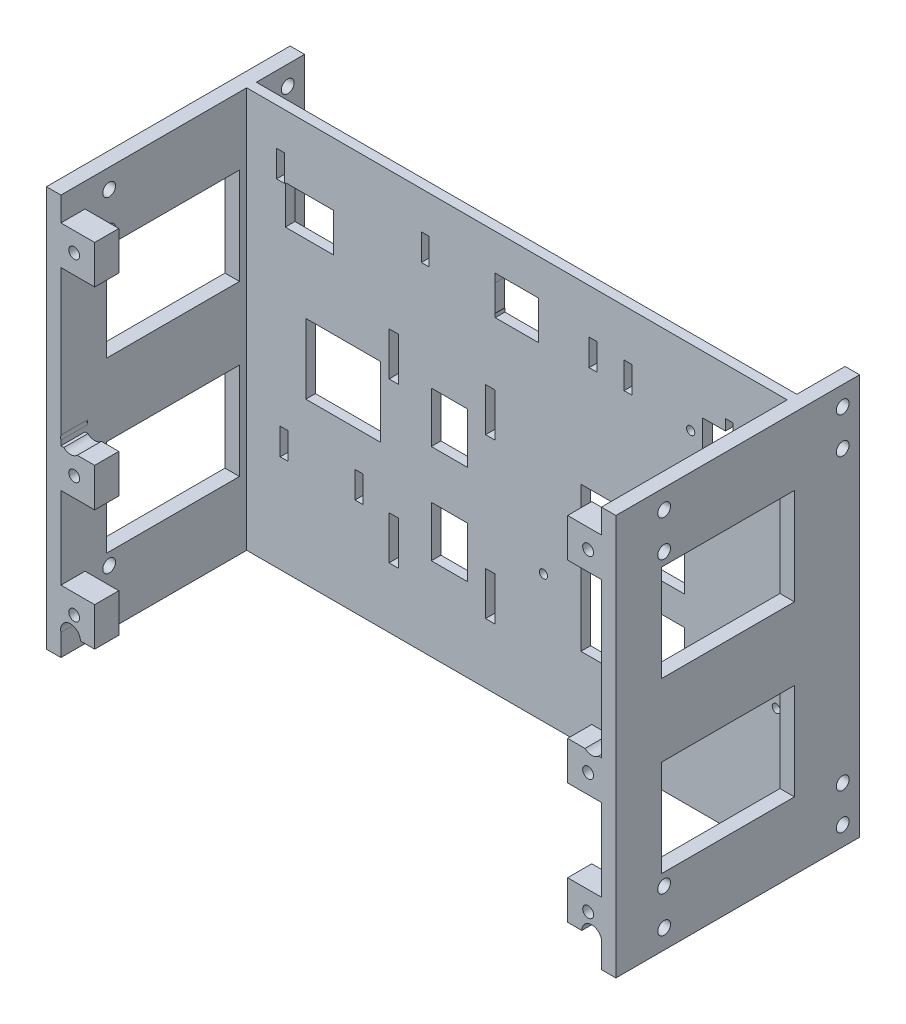
from build123d import *

# Parameters (mm, degrees)
BOTTOM_PAN_START                       = -49
SKETCH_BOTTOM_PAN_W                    = 236
SKETCH_BOTTOM_PAN_H                    = 166
BOTTOM_PAN_DEPTH                       = 4
SIDE_RAILS_START                       = -69
SKETCH_SIDE_RAILS_W                    = 6
SKETCH_SIDE_RAILS_H                    = 166
SIDE_RAILS_DEPTH                       = 101
FLOOR_VENTS_AND_STRAP_SLOTS_START      = -50
SKETCH_FLOOR_VENTS_AND_STRAP_SLOTS_W   = 4
SKETCH_FLOOR_VENTS_AND_STRAP_SLOTS_H   = 18
SKETCH_FLOOR_VENTS_AND_STRAP_SLOTS_W_2 = 15
SKETCH_FLOOR_VENTS_AND_STRAP_SLOTS_H_2 = 21
SKETCH_FLOOR_VENTS_AND_STRAP_SLOTS_W_3 = 3.2
SKETCH_FLOOR_VENTS_AND_STRAP_SLOTS_H_3 = 11
SKETCH_FLOOR_VENTS_AND_STRAP_SLOTS_W_4 = 31
SKETCH_FLOOR_VENTS_AND_STRAP_SLOTS_H_4 = 29
SKETCH_FLOOR_VENTS_AND_STRAP_SLOTS_W_5 = 20
SKETCH_FLOOR_VENTS_AND_STRAP_SLOTS_H_5 = 16
SKETCH_FLOOR_VENTS_AND_STRAP_SLOTS_W_6 = 43
SKETCH_FLOOR_VENTS_AND_STRAP_SLOTS_H_6 = 30
FLOOR_VENTS_AND_STRAP_SLOTS_DEPTH      = 7
RAIL_WINDOWS_START                     = -42
SKETCH_RAIL_WINDOWS_W                  = 9
SKETCH_RAIL_WINDOWS_H                  = 40
RAIL_WINDOWS_DEPTH                     = 55
HIP_M5_CROSS_BORES_START               = -120
SKETCH_HIP_M5_CROSS_BORES_R            = 2.65
HIP_M5_CROSS_BORES_DEPTH               = 240
SIX_DECK_BOSSES_START                  = 22
SKETCH_SIX_DECK_BOSSES_W               = 20
SKETCH_SIX_DECK_BOSSES_H               = 16
SIX_DECK_BOSSES_DEPTH                  = 10
POWER_TRAY_M3_START                    = -50
SKETCH_POWER_TRAY_M3_R                 = 1.7
POWER_TRAY_M3_DEPTH                    = 7
DECK_M4_CLEARANCE_START                = 21
SKETCH_DECK_M4_CLEARANCE_R             = 2.25
DECK_M4_CLEARANCE_DEPTH                = 12
MID_HEAD_AND_TOOL_PASSAGES_START       = 21
SKETCH_MID_HEAD_AND_TOOL_PASSAGES_R    = 4.1
MID_HEAD_AND_TOOL_PASSAGES_DEPTH       = 12
M4_HEX_CAPTURE_AF7P3_START             = 21
M4_HEX_CAPTURE_AF7P3_DEPTH             = 4.4


with BuildPart() as part:
    # Sketch_Bottom_pan → Bottom_pan (new body)
    with BuildSketch(Plane.XY.offset(BOTTOM_PAN_START)):
        Rectangle(SKETCH_BOTTOM_PAN_W, SKETCH_BOTTOM_PAN_H)
    extrude(amount=BOTTOM_PAN_DEPTH)

    # Sketch_Side_rails → Side_rails (add)
    with BuildSketch(Plane.XY.offset(SIDE_RAILS_START)):
        with Locations((-115, 0)):
            Rectangle(SKETCH_SIDE_RAILS_W, SKETCH_SIDE_RAILS_H)
        with Locations((115, 0)):
            Rectangle(SKETCH_SIDE_RAILS_W, SKETCH_SIDE_RAILS_H)
    extrude(amount=SIDE_RAILS_DEPTH)

    # Sketch_Floor_vents_and_strap_slots → Floor_vents_and_strap_slots (cut)
    with BuildSketch(Plane.XY.offset(FLOOR_VENTS_AND_STRAP_SLOTS_START)):
        with Locations((-51, -49)):
            Rectangle(SKETCH_FLOOR_VENTS_AND_STRAP_SLOTS_W, SKETCH_FLOOR_VENTS_AND_STRAP_SLOTS_H)
        with Locations((-28, -38)):
            Rectangle(SKETCH_FLOOR_VENTS_AND_STRAP_SLOTS_W_2, SKETCH_FLOOR_VENTS_AND_STRAP_SLOTS_H_2)
        with Locations((-96.5, -37)):
            Rectangle(SKETCH_FLOOR_VENTS_AND_STRAP_SLOTS_W_3, SKETCH_FLOOR_VENTS_AND_STRAP_SLOTS_H_3)
        with Locations((-65.5, -37)):
            Rectangle(SKETCH_FLOOR_VENTS_AND_STRAP_SLOTS_W_3, SKETCH_FLOOR_VENTS_AND_STRAP_SLOTS_H_3)
        with Locations((-72, -2)):
            Rectangle(SKETCH_FLOOR_VENTS_AND_STRAP_SLOTS_W_4, SKETCH_FLOOR_VENTS_AND_STRAP_SLOTS_H_4)
        with Locations((-28, 3)):
            Rectangle(SKETCH_FLOOR_VENTS_AND_STRAP_SLOTS_W_2, SKETCH_FLOOR_VENTS_AND_STRAP_SLOTS_H_2)
        with Locations((-51, 17)):
            Rectangle(SKETCH_FLOOR_VENTS_AND_STRAP_SLOTS_W, SKETCH_FLOOR_VENTS_AND_STRAP_SLOTS_H)
        with Locations((-86, 49)):
            Rectangle(SKETCH_FLOOR_VENTS_AND_STRAP_SLOTS_W_5, SKETCH_FLOOR_VENTS_AND_STRAP_SLOTS_H_5)
        with Locations((-98, 62)):
            Rectangle(SKETCH_FLOOR_VENTS_AND_STRAP_SLOTS_W_3, SKETCH_FLOOR_VENTS_AND_STRAP_SLOTS_H_3)
        with Locations((-38, 62)):
            Rectangle(SKETCH_FLOOR_VENTS_AND_STRAP_SLOTS_W_3, SKETCH_FLOOR_VENTS_AND_STRAP_SLOTS_H_3)
        with Locations((-11, -49)):
            Rectangle(SKETCH_FLOOR_VENTS_AND_STRAP_SLOTS_W, SKETCH_FLOOR_VENTS_AND_STRAP_SLOTS_H)
        with Locations((48, -35)):
            Rectangle(SKETCH_FLOOR_VENTS_AND_STRAP_SLOTS_W_6, SKETCH_FLOOR_VENTS_AND_STRAP_SLOTS_H_6)
        with Locations((48, 1)):
            Rectangle(SKETCH_FLOOR_VENTS_AND_STRAP_SLOTS_W_6, SKETCH_FLOOR_VENTS_AND_STRAP_SLOTS_H)
        with Locations((-11, 17)):
            Rectangle(SKETCH_FLOOR_VENTS_AND_STRAP_SLOTS_W, SKETCH_FLOOR_VENTS_AND_STRAP_SLOTS_H)
        Polygon((77, 45), (77, 59), (86.4, 59), (86.4, 63.5), (89.6, 63.5), (89.6, 59), (95, 59), (95, 45), align=None)
        with Locations((46, 58)):
            Rectangle(SKETCH_FLOOR_VENTS_AND_STRAP_SLOTS_W_3, SKETCH_FLOOR_VENTS_AND_STRAP_SLOTS_H_3)
        Polygon((-9, 68), (9, 68), (9, 52), (-9, 52), (-9, 53.5), (-9.1, 53.5), (-9.1, 64.5), (-9, 64.5), align=None)
        with Locations((31.5, 59)):
            Rectangle(SKETCH_FLOOR_VENTS_AND_STRAP_SLOTS_W_3, SKETCH_FLOOR_VENTS_AND_STRAP_SLOTS_H_3)
    extrude(amount=FLOOR_VENTS_AND_STRAP_SLOTS_DEPTH, mode=Mode.SUBTRACT)

    # Sketch_Rail_windows → Rail_windows (cut)
    with BuildSketch(Plane.XY.offset(RAIL_WINDOWS_START)):
        with Locations((-115, -35)):
            Rectangle(SKETCH_RAIL_WINDOWS_W, SKETCH_RAIL_WINDOWS_H)
        with Locations((115, -35)):
            Rectangle(SKETCH_RAIL_WINDOWS_W, SKETCH_RAIL_WINDOWS_H)
        with Locations((-115, 35)):
            Rectangle(SKETCH_RAIL_WINDOWS_W, SKETCH_RAIL_WINDOWS_H)
        with Locations((115, 35)):
            Rectangle(SKETCH_RAIL_WINDOWS_W, SKETCH_RAIL_WINDOWS_H)
    extrude(amount=RAIL_WINDOWS_DEPTH, mode=Mode.SUBTRACT)

    # Sketch_Hip_M5_cross_bores → Hip_M5_cross_bores (cut)
    with BuildSketch(Plane(origin=(0, 0, 0), x_dir=(0, 0, -1), z_dir=(1, 0, 0)).offset(HIP_M5_CROSS_BORES_START)):
        with Locations(Location((62, -75, 0), (0, 0, 180))):
            Circle(SKETCH_HIP_M5_CROSS_BORES_R)
        with Locations(Location((-12, -75, 0), (0, 0, 180))):
            Circle(SKETCH_HIP_M5_CROSS_BORES_R)
        with Locations(Location((62, -60, 0), (0, 0, 180))):
            Circle(SKETCH_HIP_M5_CROSS_BORES_R)
        with Locations(Location((-12, -60, 0), (0, 0, 180))):
            Circle(SKETCH_HIP_M5_CROSS_BORES_R)
        with Locations(Location((62, 60, 0), (0, 0, 180))):
            Circle(SKETCH_HIP_M5_CROSS_BORES_R)
        with Locations(Location((-12, 60, 0), (0, 0, 180))):
            Circle(SKETCH_HIP_M5_CROSS_BORES_R)
        with Locations(Location((62, 75, 0), (0, 0, 180))):
            Circle(SKETCH_HIP_M5_CROSS_BORES_R)
        with Locations(Location((-12, 75, 0), (0, 0, 180))):
            Circle(SKETCH_HIP_M5_CROSS_BORES_R)
    extrude(amount=HIP_M5_CROSS_BORES_DEPTH, mode=Mode.SUBTRACT)

    # Sketch_Six_deck_bosses → Six_deck_bosses (add)
    with BuildSketch(Plane.XY.offset(SIX_DECK_BOSSES_START)):
        with Locations((-108, -65)):
            Rectangle(SKETCH_SIX_DECK_BOSSES_W, SKETCH_SIX_DECK_BOSSES_H)
        with Locations((108, -65)):
            Rectangle(SKETCH_SIX_DECK_BOSSES_W, SKETCH_SIX_DECK_BOSSES_H)
        with Locations((-108, -15)):
            Rectangle(SKETCH_SIX_DECK_BOSSES_W, SKETCH_SIX_DECK_BOSSES_H)
        with Locations((108, -15)):
            Rectangle(SKETCH_SIX_DECK_BOSSES_W, SKETCH_SIX_DECK_BOSSES_H)
        with Locations((-108, 65)):
            Rectangle(SKETCH_SIX_DECK_BOSSES_W, SKETCH_SIX_DECK_BOSSES_H)
        with Locations((108, 65)):
            Rectangle(SKETCH_SIX_DECK_BOSSES_W, SKETCH_SIX_DECK_BOSSES_H)
    extrude(amount=SIX_DECK_BOSSES_DEPTH)

    # Sketch_Power_tray_M3 → Power_tray_M3 (cut)
    with BuildSketch(Plane.XY.offset(POWER_TRAY_M3_START)):
        with Locations((11, -30)):
            Circle(SKETCH_POWER_TRAY_M3_R)
        with Locations((107.5, -30)):
            Circle(SKETCH_POWER_TRAY_M3_R)
        with Locations((72, 52)):
            Circle(SKETCH_POWER_TRAY_M3_R)
    extrude(amount=POWER_TRAY_M3_DEPTH, mode=Mode.SUBTRACT)

    # Sketch_Deck_M4_clearance → Deck_M4_clearance (cut)
    with BuildSketch(Plane.XY.offset(DECK_M4_CLEARANCE_START)):
        with Locations(Location((-106.5, -65, 0), (0, 0, 180))):
            Circle(SKETCH_DECK_M4_CLEARANCE_R)
        with Locations(Location((-106.5, -15, 0), (0, 0, 180))):
            Circle(SKETCH_DECK_M4_CLEARANCE_R)
        with Locations(Location((-106.5, 65, 0), (0, 0, 180))):
            Circle(SKETCH_DECK_M4_CLEARANCE_R)
        with Locations(Location((106.5, -65, 0), (0, 0, 180))):
            Circle(SKETCH_DECK_M4_CLEARANCE_R)
        with Locations(Location((106.5, -15, 0), (0, 0, 180))):
            Circle(SKETCH_DECK_M4_CLEARANCE_R)
        with Locations(Location((106.5, 65, 0), (0, 0, 180))):
            Circle(SKETCH_DECK_M4_CLEARANCE_R)
    extrude(amount=DECK_M4_CLEARANCE_DEPTH, mode=Mode.SUBTRACT)

    # Sketch_MID_head_and_tool_passages → MID_head_and_tool_passages (cut)
    with BuildSketch(Plane.XY.offset(MID_HEAD_AND_TOOL_PASSAGES_START)):
        with Locations((-108, -73)):
            Circle(SKETCH_MID_HEAD_AND_TOOL_PASSAGES_R)
        with Locations((-108, -4)):
            Circle(SKETCH_MID_HEAD_AND_TOOL_PASSAGES_R)
        with Locations((108, -73)):
            Circle(SKETCH_MID_HEAD_AND_TOOL_PASSAGES_R)
        with Locations((108, -4)):
            Circle(SKETCH_MID_HEAD_AND_TOOL_PASSAGES_R)
    extrude(amount=MID_HEAD_AND_TOOL_PASSAGES_DEPTH, mode=Mode.SUBTRACT)

    # Sketch_M4_hex_capture_AF7p3 → M4_hex_capture_AF7p3 (cut)
    with BuildSketch(Plane.XY.offset(M4_HEX_CAPTURE_AF7P3_START)):
        Polygon((-102.285343035, -65), (-104.392671517, -61.35), (-108.607328483, -61.35), (-110.714656965, -65), (-108.607328483, -68.65), (-104.392671517, -68.65), align=None)
        Polygon((-102.285343035, -15), (-104.392671517, -11.35), (-108.607328483, -11.35), (-110.714656965, -15), (-108.607328483, -18.65), (-104.392671517, -18.65), align=None)
        Polygon((-102.285343035, 65), (-104.392671517, 68.65), (-108.607328483, 68.65), (-110.714656965, 65), (-108.607328483, 61.35), (-104.392671517, 61.35), align=None)
        Polygon((110.714656965, -65), (108.607328483, -61.35), (104.392671517, -61.35), (102.285343035, -65), (104.392671517, -68.65), (108.607328483, -68.65), align=None)
        Polygon((110.714656965, -15), (108.607328483, -11.35), (104.392671517, -11.35), (102.285343035, -15), (104.392671517, -18.65), (108.607328483, -18.65), align=None)
        Polygon((110.714656965, 65), (108.607328483, 68.65), (104.392671517, 68.65), (102.285343035, 65), (104.392671517, 61.35), (108.607328483, 61.35), align=None)
    extrude(amount=M4_HEX_CAPTURE_AF7P3_DEPTH, mode=Mode.SUBTRACT)


solid = part.part
